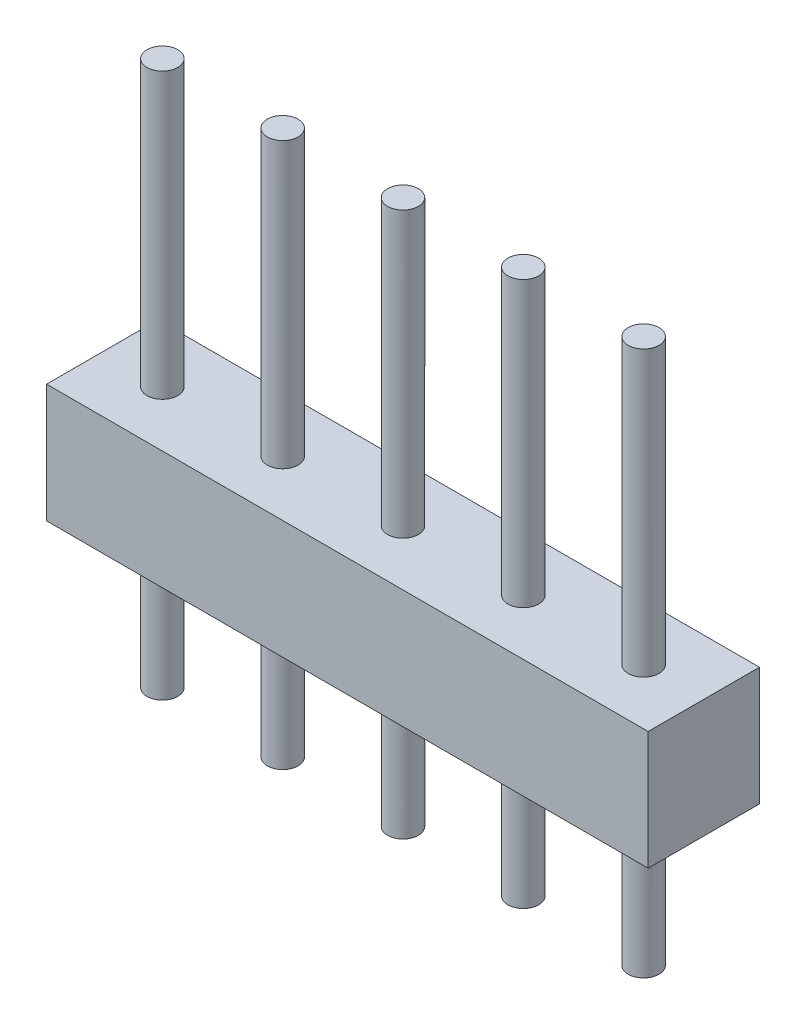
from build123d import *

# Parameters (mm, degrees)
ESQUISSE1_W                = 2.54
ESQUISSE1_H                = 2.35
BOSS_EXTRU_1_DEPTH         = 2.5
BOSS_EXTRU_2_START         = -3
ESQUISSE2_R                = 0.325
BOSS_EXTRU_2_DEPTH         = 11.5
R_P_TITION_LIN_AIRE1_COUNT = 5
R_P_TITION_LIN_AIRE1_PITCH = 2.54


with BuildPart() as part:
    # Esquisse1 → Boss.-Extru.1 (new body)
    with BuildSketch(Plane(origin=(0, 0, 0), x_dir=(1, 0, 0), z_dir=(0, 1, 0))):
        with Locations((1.27, 1.175)):
            Rectangle(ESQUISSE1_W, ESQUISSE1_H)
    boss_extru_1 = extrude(amount=BOSS_EXTRU_1_DEPTH)

    # Esquisse2 → Boss.-Extru.2 (add)
    with BuildSketch(Plane(origin=(0, 0, 0), x_dir=(1, 0, 0), z_dir=(0, 1, 0)).offset(BOSS_EXTRU_2_START)):
        with Locations(Location((1.27, 1.175, 0), (0, 0, 270))):
            Circle(ESQUISSE2_R)
    boss_extru_2 = extrude(amount=BOSS_EXTRU_2_DEPTH)

    # Répétition linéaire1: Boss.-Extru.1, Boss.-Extru.2 ×5
    with Locations(*[(i * R_P_TITION_LIN_AIRE1_PITCH, 0, 0) for i in range(1, R_P_TITION_LIN_AIRE1_COUNT)]):
        add(boss_extru_1)
        add(boss_extru_2)


solid = part.part
